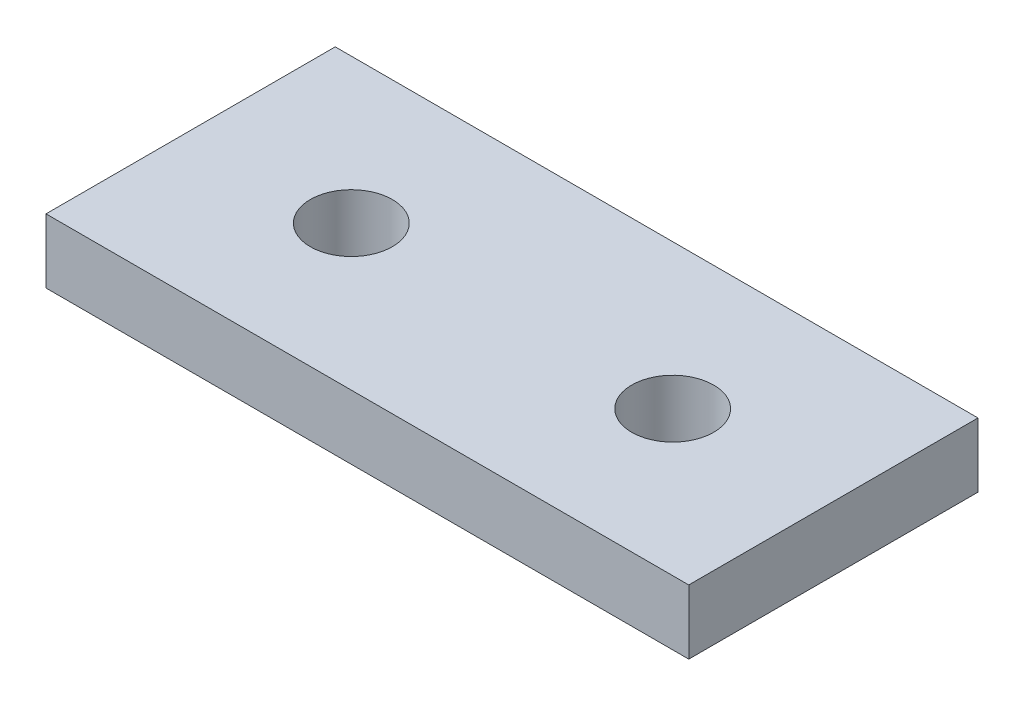
from build123d import *

# Parameters (mm, degrees)
SKETCH1_W           = 40
SKETCH1_H           = 18
SKETCH1_R           = 2.55
BOSS_EXTRUDE1_DEPTH = 4


with BuildPart() as part:
    # Sketch1 → Boss-Extrude1 (new body)
    with BuildSketch(Plane(origin=(0, 0, 0), x_dir=(1, 0, 0), z_dir=(0, 1, 0))):
        Rectangle(SKETCH1_W, SKETCH1_H)
        with Locations(Location((-10, 0, 0), (0, 0, 270))):
            Circle(SKETCH1_R, mode=Mode.SUBTRACT)
        with Locations(Location((10, 0, 0), (0, 0, 90))):
            Circle(SKETCH1_R, mode=Mode.SUBTRACT)
    extrude(amount=BOSS_EXTRUDE1_DEPTH)


solid = part.part
